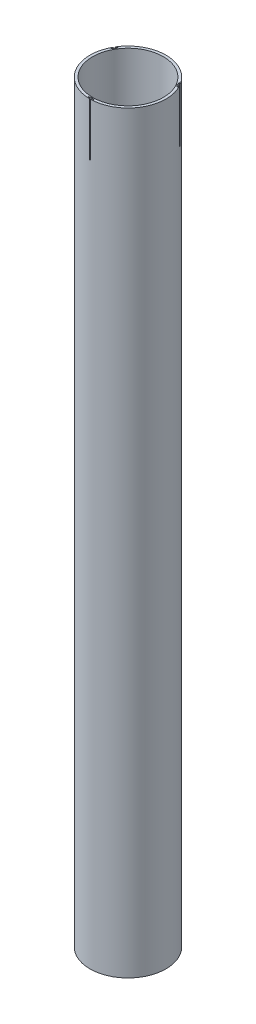
from build123d import *

# Parameters (mm, degrees)
SKETCH1_R           = 57.5
BOSS_EXTRUDE1_DEPTH = 570
SHELL1_T            = -4
CUT_EXTRUDE4_DEPTH  = 80
CIRPATTERN1_COUNT   = 3
BOSS_EXTRUDE3_START = -5
BOSS_EXTRUDE3_DEPTH = 5


with BuildPart() as part:
    # Sketch1 → Boss-Extrude1 (new, symmetric)
    with BuildSketch(Plane(origin=(0, 0, 0), x_dir=(1, 0, 0), z_dir=(0, 1, 0))):
        with Locations(Location((0, 0, 0), (0, 0, 270))):
            Circle(SKETCH1_R)
    extrude(amount=BOSS_EXTRUDE1_DEPTH, both=True)

    # Shell1
    shell1_openings = [part.faces().sort_by_distance(p)[0] for p in [
        (0, 570, 0),
        (0, -570, 0),
    ]]
    offset(amount=SHELL1_T, openings=shell1_openings, kind=Kind.INTERSECTION)

    # Sketch2 → Cut-Extrude4 (cut)
    with BuildSketch(Plane(origin=(0, 570, 0), x_dir=(1, 0, 0), z_dir=(0, 1, 0))):
        with BuildLine():
            Line((1, -57.49130369), (1, -56.50869631))
            Line((1, -56.50869631), (4, -56.50869631))
            Line((4, -56.50869631), (4, -55.50869631))
            Line((4, -55.50869631), (0, -54.50869631))
            Line((0, -54.50869631), (-4, -55.50869631))
            Line((-4, -55.50869631), (-4, -56.50869631))
            Line((-4, -56.50869631), (-1, -56.50869631))
            Line((-1, -56.50869631), (-1, -57.49130369))
            ThreePointArc((-1, -57.49130369), (0, -57.5), (1, -57.49130369))
        make_face()
    cut_extrude4 = extrude(amount=-CUT_EXTRUDE4_DEPTH, mode=Mode.SUBTRACT)

    # CirPattern1: Cut-Extrude4 ×3 about axis
    cirpattern1_axis = Axis((0, 0, 0), (0, 1, 0))
    for i in range(1, CIRPATTERN1_COUNT):
        add(cut_extrude4.rotate(cirpattern1_axis, i * 360 / CIRPATTERN1_COUNT), mode=Mode.SUBTRACT)

    # Sketch4 → Boss-Extrude3 (add)
    with BuildSketch(Plane(origin=(0, -570, 0), x_dir=(-1, 0, 0), z_dir=(0, -1, 0)).offset(BOSS_EXTRUDE3_START)):
        with BuildLine():
            Line((4.482088094, 53.311920677), (2.136322363, 25.410354715))
            ThreePointArc((2.136322363, 25.410354715), (-4.5131548, 25.097438789), (-10.855067921, 23.074173884))
            Line((-10.855067921, 23.074173884), (-22.774358187, 48.410521678))
            ThreePointArc((-22.774358187, 48.410521678), (-9.468775757, 52.655410792), (4.482088094, 53.311920677))
        make_face()
        with BuildLine():
            Line((-4.482088094, -53.311920677), (-2.136322363, -25.410354715))
            ThreePointArc((-2.136322363, -25.410354715), (4.5131548, -25.097438789), (10.855067921, -23.074173884))
            Line((10.855067921, -23.074173884), (22.774358187, -48.410521678))
            ThreePointArc((22.774358187, -48.410521678), (9.468775757, -52.655410792), (-4.482088094, -53.311920677))
        make_face()
    extrude(amount=BOSS_EXTRUDE3_DEPTH)


solid = part.part
